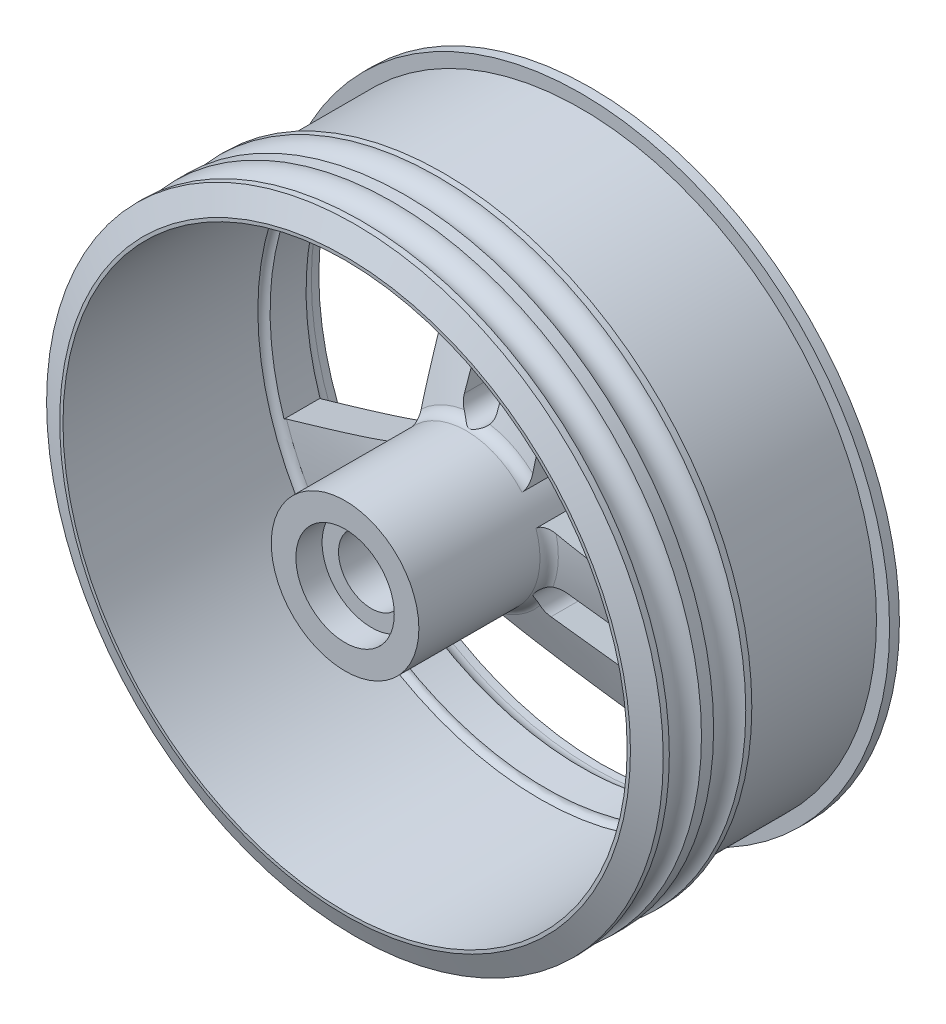
from build123d import *

# Parameters (mm, degrees)
CUT_EXTRUDE2_DEPTH      = 72.01408311
CUT_EXTRUDE2_DEPTH_BACK = 72.01408311
SKETCH3_R               = 7.5
CUT_EXTRUDE3_DEPTH      = 4
CUT_EXTRUDE4_START      = -4
SKETCH4_R               = 7.5
CUT_EXTRUDE4_DEPTH      = 4


with BuildPart() as part:
    # Sketch1 → Revolve2 (revolve)
    with BuildSketch(Plane(origin=(0, 0, 0), x_dir=(1, 0, 0), z_dir=(0, 1, 0)), mode=Mode.PRIVATE) as revolve2_sk:
        with BuildLine():
            Line((-11.174557458, 0), (-5, 0))
            Line((-5, 0), (-5, -25))
            Line((-5, -25), (-11.25, -25))
            Line((-11.25, -25), (-11.25, -6.536712421))
            ThreePointArc((-11.25, -6.536712421), (-11.567667833, -5.534031792), (-12.404763136, -4.897201557))
            Line((-12.404763136, -4.897201557), (-41.543118733, 5.526275241))
            ThreePointArc((-41.543118733, 5.526275241), (-42.445397084, 5.424819026), (-43, 4.70592043))
            Line((-43, 4.70592043), (-43, -25))
            Line((-43, -25), (-43.5, -25))
            Line((-43.5, -25), (-47, -23.5))
            Line((-47, -23.5), (-47, -22.572243222))
            ThreePointArc((-47, -22.572243222), (-45, -20.12275348), (-47, -17.673263737))
            Line((-47, -17.673263737), (-47, -15.822243222))
            ThreePointArc((-47, -15.822243222), (-45, -13.37275348), (-47, -10.923263737))
            Line((-47, -10.923263737), (-47, -9.998263737))
            Line((-47, -9.998263737), (-45, -9.998263737))
            Line((-45, -9.998263737), (-45, 11))
            Line((-45, 11), (-47, 11))
            Line((-47, 11), (-47, 12.5))
            Line((-47, 12.5), (-43.5, 14))
            Line((-43.5, 14), (-43, 14))
            Line((-43, 14), (-43, 12.857723577))
            ThreePointArc((-43, 12.857723577), (-42.611470899, 11.631377807), (-41.587647106, 10.852491648))
            Line((-41.587647106, 10.852491648), (-11.321034328, 0.025410654))
            ThreePointArc((-11.321034328, 0.025410654), (-11.248889777, 0.006399753), (-11.174557458, 0))
        make_face()
    revolve(revolve2_sk.sketch.rotate(Axis((0, 0, 31.339901162), (0, 0, -1)), 180), axis=Axis((0, 0, 31.339901162), (0, 0, -1)))

    # Sketch2 → Cut-Extrude2 (cut, two sides: drawn at the far end of the back side and taken through both)
    with BuildSketch(Plane.XY.offset(-CUT_EXTRUDE2_DEPTH_BACK)):
        with BuildLine():
            Line((-8.5, 7.369701486), (-8.5, 41.130888636))
            ThreePointArc((-8.5, 41.130888636), (-36.373066959, 21), (-39.870394439, -13.204228386))
            Line((-39.870394439, -13.204228386), (-10.632348706, 3.676365189))
            ThreePointArc((-10.632348706, 3.676365189), (-9.742785793, 5.625), (-8.5, 7.369701486))
        make_face()
        with BuildLine():
            Line((8.5, 41.130888636), (8.5, 7.369701486))
            ThreePointArc((8.5, 7.369701486), (9.742785793, 5.625), (10.632348706, 3.676365189))
            Line((10.632348706, 3.676365189), (39.870394439, -13.204228386))
            ThreePointArc((39.870394439, -13.204228386), (36.373066959, 21), (8.5, 41.130888636))
        make_face()
        with BuildLine():
            Line((2.5, 33.807017959), (2.5, 13.807017959))
            ThreePointArc((2.5, 13.807017959), (0, 11.307017959), (-2.5, 13.807017959))
            Line((-2.5, 13.807017959), (-2.5, 33.807017959))
            ThreePointArc((-2.5, 33.807017959), (0, 36.307017959), (2.5, 33.807017959))
        make_face()
        with BuildLine():
            Line((31.370394439, -27.92666025), (2.132348706, -11.046066675))
            ThreePointArc((2.132348706, -11.046066675), (0, -11.25), (-2.132348706, -11.046066675))
            Line((-2.132348706, -11.046066675), (-31.370394439, -27.92666025))
            ThreePointArc((-31.370394439, -27.92666025), (0, -42), (31.370394439, -27.92666025))
        make_face()
        with BuildLine():
            Line((28.027736379, -19.068572489), (10.707228303, -9.068572489))
            ThreePointArc((10.707228303, -9.068572489), (9.792164794, -5.65350898), (13.207228303, -4.73844547))
            Line((13.207228303, -4.73844547), (30.527736379, -14.73844547))
            ThreePointArc((30.527736379, -14.73844547), (31.442799888, -18.15350898), (28.027736379, -19.068572489))
        make_face()
        with BuildLine():
            Line((-30.527736379, -14.73844547), (-13.207228303, -4.73844547))
            ThreePointArc((-13.207228303, -4.73844547), (-9.792164794, -5.65350898), (-10.707228303, -9.068572489))
            Line((-10.707228303, -9.068572489), (-28.027736379, -19.068572489))
            ThreePointArc((-28.027736379, -19.068572489), (-31.442799888, -18.15350898), (-30.527736379, -14.73844547))
        make_face()
    extrude(amount=CUT_EXTRUDE2_DEPTH + CUT_EXTRUDE2_DEPTH_BACK, mode=Mode.SUBTRACT)

    # Sketch3 → Cut-Extrude3 (cut)
    with BuildSketch(Plane(origin=(0, 0, 0), x_dir=(-1, 0, 0), z_dir=(0, 0, -1))):
        Circle(SKETCH3_R)
    extrude(amount=-CUT_EXTRUDE3_DEPTH, mode=Mode.SUBTRACT)

    # Sketch4 → Cut-Extrude4 (cut)
    with BuildSketch(Plane.XY.offset(25).offset(CUT_EXTRUDE4_START)):
        with Locations(Location((0, 0, 0), (0, 0, 180))):
            Circle(SKETCH4_R)
    extrude(amount=CUT_EXTRUDE4_DEPTH, mode=Mode.SUBTRACT)


solid = part.part
